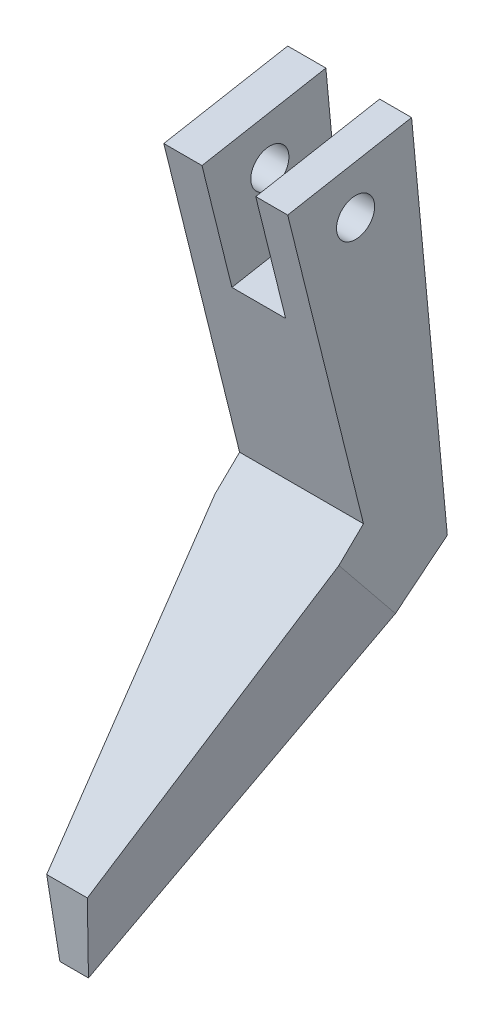
from build123d import *

# Parameters (mm, degrees)
EXTRUDE_1_DEPTH     = 130
CUT_EXTRUDE_1_DEPTH = 130
SKETCH_3_W          = 56.400423759
SKETCH_3_H          = 132.12352691
CUT_EXTRUDE_2_DEPTH = 130
SKETCH_4_R          = 20
CUT_EXTRUDE_4_DEPTH = 536.34382743


with BuildPart() as part:
    # 草图1 → 凸台-拉伸1 (new body)
    with BuildSketch(Plane(origin=(0, 0, 0), x_dir=(0, 0, -1), z_dir=(1, 0, 0))):
        Polygon((-117.413418414, 203.995173877), (12.586581586, 227.58810424), (50.05442381, -170.65323063), (-276.483750531, -434.798684306), (-283.977318976, -355.150417332), (-37.902557252, -116.282866203), align=None)
    extrude(amount=EXTRUDE_1_DEPTH)

    # 草图2 → 切除-拉伸1 (cut)
    with BuildSketch(Plane(origin=(0, -127.628376299, -103.242003565), x_dir=(1, 0, 0), z_dir=(0, -0.7774718436693089, -0.6289177468488591))):
        Polygon((130, 138.410940137), (80, 488.410940137), (130, 488.410940137), align=None)
        Polygon((50, 488.410940137), (0, 138.410940137), (0, 488.410940137), align=None)
    extrude(amount=-CUT_EXTRUDE_1_DEPTH, mode=Mode.SUBTRACT)

    # 草图3 → 切除-拉伸2 (cut)
    with BuildSketch(Plane(origin=(0, 218.119745355, 39.585261254), x_dir=(1, 0, 0), z_dir=(0, 0.9839277155275394, 0.17856721596294645))):
        with Locations((68.261248993, -13.037702829)):
            Rectangle(SKETCH_3_W, SKETCH_3_H)
    extrude(amount=-CUT_EXTRUDE_2_DEPTH, mode=Mode.SUBTRACT)

    # 草图4 → 切除-拉伸4 (cut, through all)
    with BuildSketch(Plane.ZY):
        with Locations((46.203978927, 166.178708675)):
            Circle(SKETCH_4_R)
    extrude(amount=-CUT_EXTRUDE_4_DEPTH, mode=Mode.SUBTRACT)


solid = part.part
